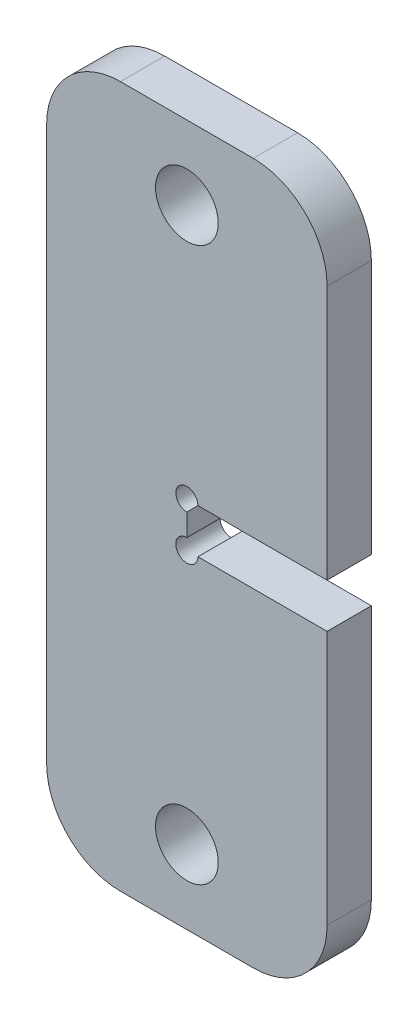
from build123d import *

# Parameters (mm, degrees)
BOSS_EXTRUDE1_START = 5
SKETCH1_R           = 4.25
BOSS_EXTRUDE1_DEPTH = 6
SKETCH3_R           = 1.5
CUT_EXTRUDE1_DEPTH  = 839.535032065


with BuildPart() as part:
    # Sketch1 → Boss-Extrude1 (new body)
    with BuildSketch(Plane.XY.offset(BOSS_EXTRUDE1_START)):
        with BuildLine():
            Line((724, 378.5), (724, 413))
            ThreePointArc((724, 413), (721.071067812, 420.071067812), (714, 423))
            Line((714, 423), (696, 423))
            ThreePointArc((696, 423), (688.928932188, 420.071067812), (686, 413))
            Line((686, 413), (686, 338))
            ThreePointArc((686, 338), (688.928932188, 330.928932188), (696, 328))
            Line((696, 328), (714, 328))
            ThreePointArc((714, 328), (721.071067812, 330.928932188), (724, 338))
            Line((724, 338), (724, 372.5))
            Line((724, 372.5), (705, 372.5))
            Line((705, 372.5), (705, 378.5))
            Line((705, 378.5), (724, 378.5))
        make_face()
        with Locations((705, 338)):
            Circle(SKETCH1_R, mode=Mode.SUBTRACT)
        with Locations((705, 413)):
            Circle(SKETCH1_R, mode=Mode.SUBTRACT)
    extrude(amount=BOSS_EXTRUDE1_DEPTH)

    # Sketch3 → Cut-Extrude1 (cut, through all)
    with BuildSketch(Plane.XY.offset(11)):
        with Locations((705, 378.5)):
            Circle(SKETCH3_R)
        with Locations((705, 372.5)):
            Circle(SKETCH3_R)
    extrude(amount=-CUT_EXTRUDE1_DEPTH, mode=Mode.SUBTRACT)


solid = part.part
